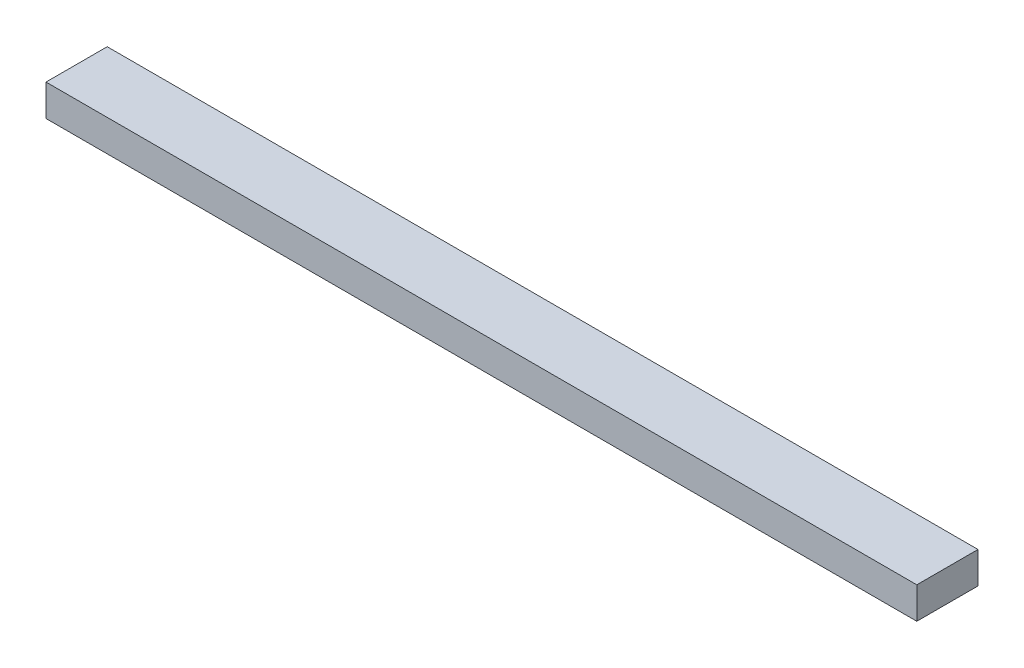
from build123d import *

# Parameters (mm, degrees)
ESQUISSE1_W        = 175
ESQUISSE1_H        = 12.3
BOSS_EXTRU_1_DEPTH = 6.35


with BuildPart() as part:
    # Esquisse1 → Boss.-Extru.1 (new body)
    with BuildSketch(Plane(origin=(0, 0, 0), x_dir=(1, 0, 0), z_dir=(0, 1, 0))):
        Rectangle(ESQUISSE1_W, ESQUISSE1_H)
    extrude(amount=BOSS_EXTRU_1_DEPTH)


solid = part.part
